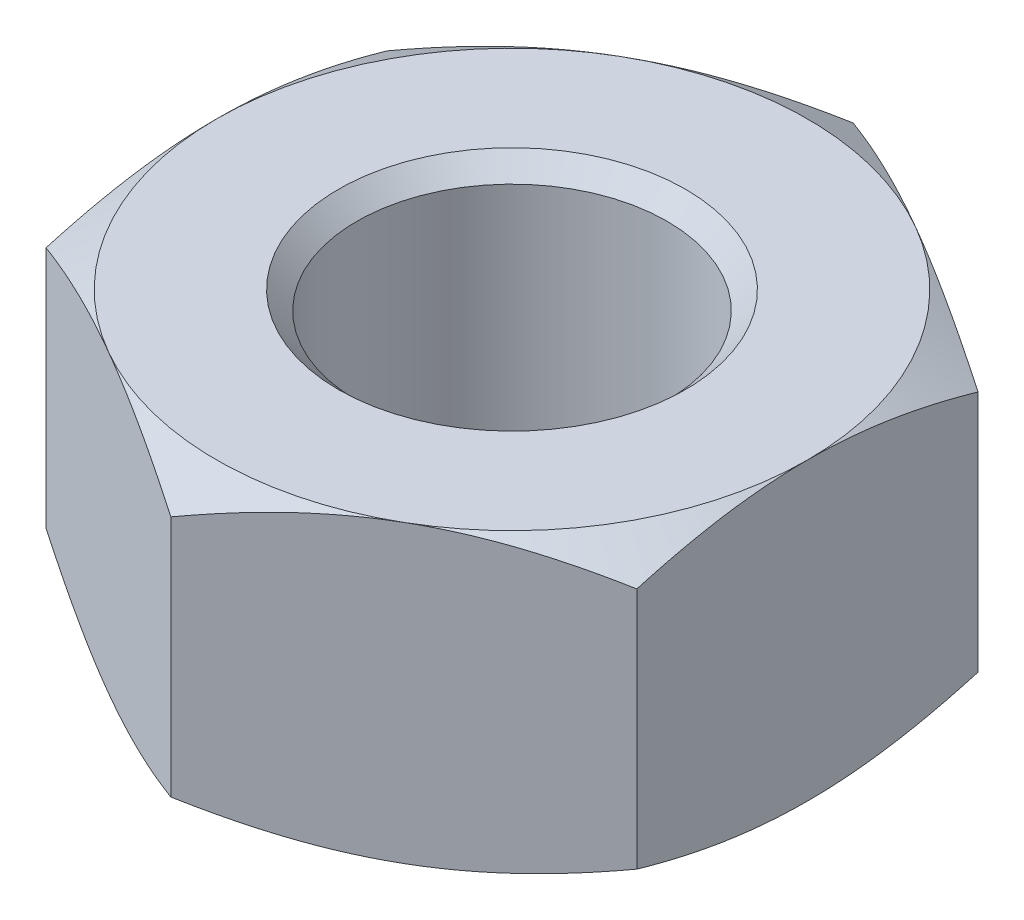
from build123d import *

# Parameters (mm, degrees)
BOSS_EXTRUDE1_DEPTH     = 2
SKETCH2_OUTSIDE_W       = 20.886
SKETCH2_OUTSIDE_H       = 22.124
SKETCH2_OUTSIDE_R       = 4
CUT_EXTRUDE1_DEPTH      = 2.4
CUT_EXTRUDE1_DRAFT      = -60
MIRROR1_COPY_1_SKETCH_W = 20.886
MIRROR1_COPY_1_SKETCH_H = 22.124
MIRROR1_COPY_1_SKETCH_R = 4
MIRROR1_COPY_1_DEPTH    = 2.4
MIRROR1_COPY_1_DRAFT    = -60
TAPPED_HOLE0_D          = 4.2
CHAMFER1_SIZE           = 0.25


with BuildPart() as part:
    # Sketch1 → Boss-Extrude1 (new, symmetric)
    with BuildSketch(Plane(origin=(0, 0, 0), x_dir=(1, 0, 0), z_dir=(0, 1, 0))):
        Polygon((4, -2.309401077), (4, 2.309401077), (0, 4.618802154), (-4, 2.309401077), (-4, -2.309401077), (0, -4.618802154), align=None)
    extrude(amount=BOSS_EXTRUDE1_DEPTH, both=True)


with BuildPart() as cut_extrude1_tool:
    # Sketch2 outside → Cut-Extrude1 (with draft: the straight prism first)
    with BuildSketch(Plane(origin=(0, 2, 0), x_dir=(1, 0, 0), z_dir=(0, 1, 0))):
        Rectangle(SKETCH2_OUTSIDE_W, SKETCH2_OUTSIDE_H)
        Circle(SKETCH2_OUTSIDE_R, mode=Mode.SUBTRACT)
    extrude(amount=-CUT_EXTRUDE1_DEPTH)
    # Cut-Extrude1: the draft: its side faces are tilted about the plane it starts from
    cut_extrude1_sides = [cut_extrude1_tool.faces().sort_by_distance(p)[0] for p in [
        (0, 0.8, 11.062),
        (10.443, 0.8, 0),
        (0, 0.8, -11.062),
        (-10.443, 0.8, 0),
        (-4, 0.8, 0),
    ]]
    draft(cut_extrude1_sides, Plane(origin=(0, 2, 0), x_dir=(1, 0, 0), z_dir=(0, 1, 0)), CUT_EXTRUDE1_DRAFT)


with BuildPart() as part_1:
    add(part.part)

    # Cut-Extrude1: cut by cut_extrude1_tool
    add(cut_extrude1_tool.part, mode=Mode.SUBTRACT)


with BuildPart() as mirror1_copy_1_tool:
    # Mirror1 copy 1 sketch → Mirror1 copy 1 (with draft: the straight prism first)
    with BuildSketch(Plane.XZ.offset(2)):
        Rectangle(MIRROR1_COPY_1_SKETCH_W, MIRROR1_COPY_1_SKETCH_H)
        Circle(MIRROR1_COPY_1_SKETCH_R, mode=Mode.SUBTRACT)
    extrude(amount=-MIRROR1_COPY_1_DEPTH)
    # Mirror1 copy 1: the draft: its side faces are tilted about the plane it starts from
    mirror1_copy_1_sides = [mirror1_copy_1_tool.faces().sort_by_distance(p)[0] for p in [
        (0, -0.8, 11.062),
        (10.443, -0.8, 0),
        (0, -0.8, -11.062),
        (-10.443, -0.8, 0),
        (-4, -0.8, 0),
    ]]
    draft(mirror1_copy_1_sides, Plane.XZ.offset(2), MIRROR1_COPY_1_DRAFT)


with BuildPart() as part_2:
    add(part_1.part)

    # Mirror1 copy 1: cut by mirror1_copy_1_tool
    add(mirror1_copy_1_tool.part, mode=Mode.SUBTRACT)

    # Tapped Hole0 (through all)
    with Locations(Plane(origin=(0, -2, 0), x_dir=(-1, 0, 0), z_dir=(0, -1, 0))):
        with Locations((0, 0)):
            Hole(TAPPED_HOLE0_D / 2)

    # Chamfer1
    chamfer1_edges = [part_2.edges().sort_by_distance(p)[0] for p in [
        (-2.1, -2, 0),
        (-2.1, 2, 0),
    ]]
    chamfer(chamfer1_edges, length=CHAMFER1_SIZE)


solid = part_2.part
